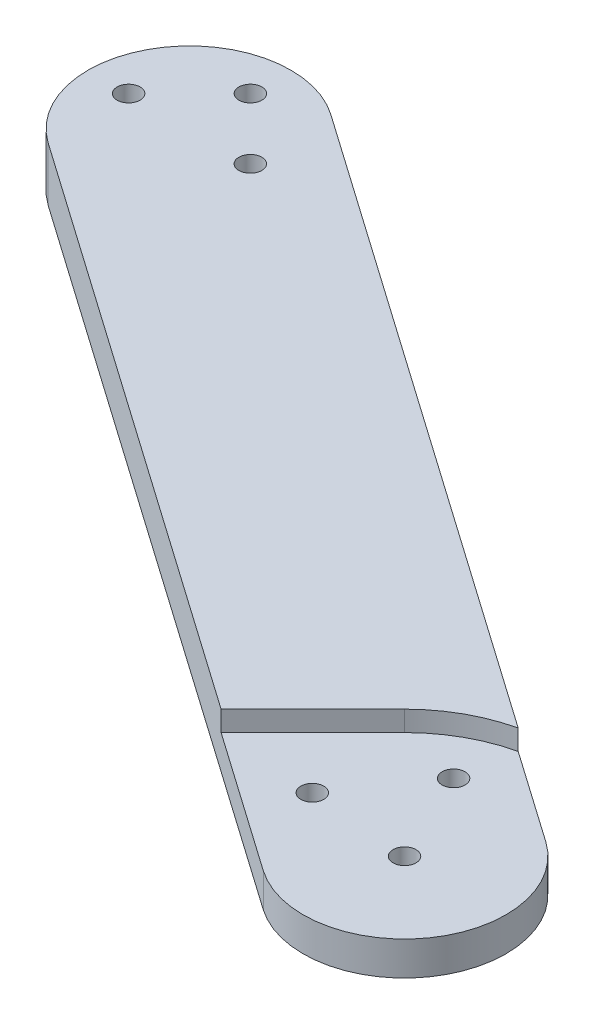
from build123d import *

# Parameters (mm, degrees)
BOSS_EXTRUDE1_DEPTH     = 8
CUT_EXTRUDE1_START      = 8
CUT_EXTRUDE1_DEPTH      = 3
SKETCH1_12_R            = 1.7
CUT_EXTRUDE2_DEPTH      = 4
CUT_EXTRUDE3_DEPTH      = 230.948791245
CUT_EXTRUDE3_DEPTH_BACK = 230.948791245
SKETCH1_13_R            = 1.7


with BuildPart() as part:
    # Sketch1 → Boss-Extrude1 (new body)
    with BuildSketch(Plane(origin=(0, 0, 0), x_dir=(1, 0, 0), z_dir=(0, 1, 0))):
        with BuildLine():
            Line((97.462370633, 93.778736514), (-8.603646545, 168.04696129))
            ThreePointArc((-8.603646545, 168.04696129), (-12.287280664, 188.937888499), (8.603646545, 192.621522618))
            Line((8.603646545, 192.621522618), (114.669663723, 118.353297842))
            ThreePointArc((114.669663723, 118.353297842), (118.353297842, 97.462370633), (97.462370633, 93.778736514))
        make_face()
    extrude(amount=BOSS_EXTRUDE1_DEPTH)

    # Sketch1<11> → Cut-Extrude1 (cut)
    with BuildSketch(Plane(origin=(0, 0, 0), x_dir=(1, 0, 0), z_dir=(0, 1, 0)).offset(CUT_EXTRUDE1_START)):
        with BuildLine():
            Line((-15.839191899, 15.839191899), (90.226825279, 121.905209077))
            ThreePointArc((90.226825279, 121.905209077), (121.905209077, 121.905209077), (121.905209077, 90.226825279))
            Line((121.905209077, 90.226825279), (15.839191899, -15.839191899))
            ThreePointArc((15.839191899, -15.839191899), (-15.839191899, -15.839191899), (-15.839191899, 15.839191899))
        make_face()
    extrude(amount=-CUT_EXTRUDE1_DEPTH, mode=Mode.SUBTRACT)

    # Sketch1<12> → Cut-Extrude2 (cut)
    with BuildSketch(Plane(origin=(0, 0, 0), x_dir=(1, 0, 0), z_dir=(0, 1, 0))):
        with BuildLine():
            ThreePointArc((8.603646545, 192.621522618), (-9.076410828, 192.276551885), (-14.142135624, 175.334241954))
            Line((-14.142135624, 175.334241954), (33.292441968, 175.334241954))
            Line((33.292441968, 175.334241954), (8.603646545, 192.621522618))
        make_face()
        with Locations(Location((-9, 180.334241954, 0), (0, 0, 270))):
            Circle(SKETCH1_12_R, mode=Mode.SUBTRACT)
        with Locations(Location((0, 189.334241954, 0), (0, 0, 270))):
            Circle(SKETCH1_12_R, mode=Mode.SUBTRACT)
        with Locations(Location((9, 180.334241954, 0), (0, 0, 270))):
            Circle(SKETCH1_12_R, mode=Mode.SUBTRACT)
    extrude(amount=CUT_EXTRUDE2_DEPTH, mode=Mode.SUBTRACT)

    # Sketch1<13> → Cut-Extrude3 (cut, two sides: drawn at the far end of the back side and taken through both)
    with BuildSketch(Plane(origin=(0, 0, 0), x_dir=(1, 0, 0), z_dir=(0, 1, 0)).offset(-CUT_EXTRUDE3_DEPTH_BACK)):
        with Locations(Location((0, 189.334241954, 0), (0, 0, 270))):
            Circle(SKETCH1_13_R)
        with Locations(Location((-9, 180.334241954, 0), (0, 0, 270))):
            Circle(SKETCH1_13_R)
        with Locations(Location((9, 180.334241954, 0), (0, 0, 270))):
            Circle(SKETCH1_13_R)
        with Locations(Location((99.718863875, 119.666151183, 0), (0, 0, 270))):
            Circle(SKETCH1_13_R)
        with Locations(Location((91.11521733, 107.378870518, 0), (0, 0, 270))):
            Circle(SKETCH1_13_R)
        with Locations(Location((106.066017178, 106.066017178, 0), (0, 0, 270))):
            Circle(SKETCH1_13_R)
    extrude(amount=CUT_EXTRUDE3_DEPTH + CUT_EXTRUDE3_DEPTH_BACK, mode=Mode.SUBTRACT)


solid = part.part
